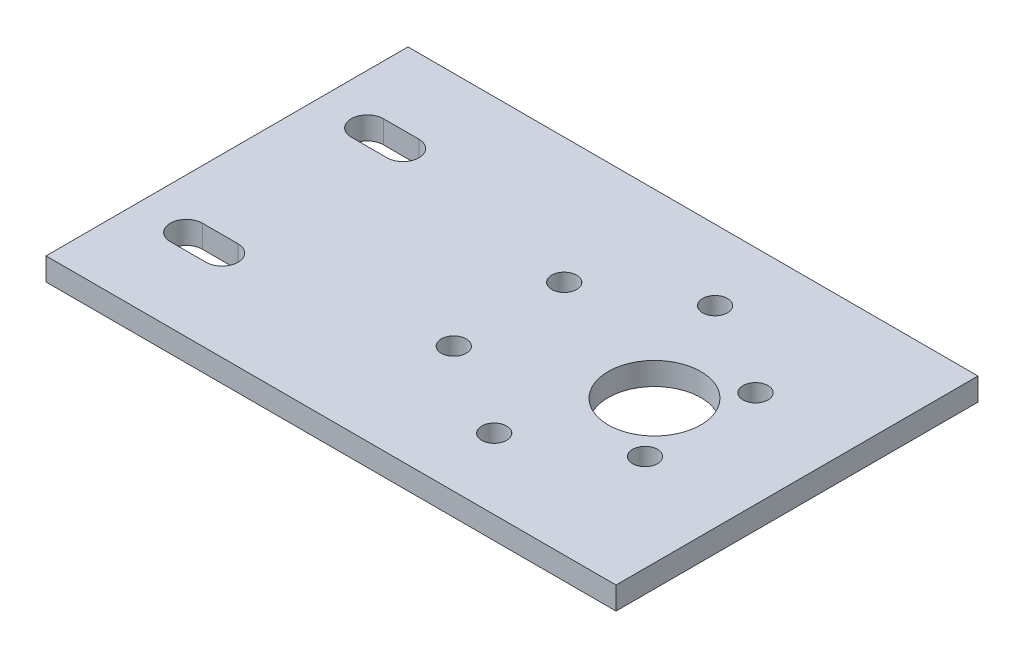
from build123d import *

# Parameters (mm, degrees)
SKETCH1_W           = 80
SKETCH1_H           = 38.1
SKETCH1_R           = 6.5
SKETCH1_R_2         = 1.75
BOSS_EXTRUDE1_DEPTH = 3.175
SKETCH2_W           = 80
SKETCH2_H           = 6.35
BOSS_EXTRUDE2_DEPTH = 3.175


with BuildPart() as part:
    # Sketch1 → Boss-Extrude1 (new body)
    with BuildSketch(Plane(origin=(0, 0, 0), x_dir=(1, 0, 0), z_dir=(0, 1, 0))):
        with Locations((62.55, 19.05)):
            Rectangle(SKETCH1_W, SKETCH1_H)
        with Locations(Location((82.55, 19.05, 0), (0, 0, 270))):
            Circle(SKETCH1_R, mode=Mode.SUBTRACT)
        with Locations(Location((75.55, 34.55, 0), (0, 0, 270))):
            Circle(SKETCH1_R_2, mode=Mode.SUBTRACT)
        with Locations(Location((88.973393759, 26.8, 0), (0, 0, 270))):
            Circle(SKETCH1_R_2, mode=Mode.SUBTRACT)
        with Locations(Location((88.973393759, 11.3, 0), (0, 0, 270))):
            Circle(SKETCH1_R_2, mode=Mode.SUBTRACT)
        with Locations(Location((75.55, 3.55, 0), (0, 0, 270))):
            Circle(SKETCH1_R_2, mode=Mode.SUBTRACT)
        with Locations(Location((62.126606241, 11.3, 0), (0, 0, 270))):
            Circle(SKETCH1_R_2, mode=Mode.SUBTRACT)
        with Locations(Location((62.126606241, 26.8, 0), (0, 0, 270))):
            Circle(SKETCH1_R_2, mode=Mode.SUBTRACT)
        with BuildLine():
            Line((29.55, 29.5), (34.55, 29.5))
            ThreePointArc((34.55, 29.5), (36.8, 31.75), (34.55, 34))
            Line((34.55, 34), (29.55, 34))
            ThreePointArc((29.55, 34), (27.3, 31.75), (29.55, 29.5))
        make_face(mode=Mode.SUBTRACT)
        with BuildLine():
            Line((29.55, 4.1), (34.55, 4.1))
            ThreePointArc((34.55, 4.1), (36.8, 6.35), (34.55, 8.6))
            Line((34.55, 8.6), (29.55, 8.6))
            ThreePointArc((29.55, 8.6), (27.3, 6.35), (29.55, 4.1))
        make_face(mode=Mode.SUBTRACT)
    extrude(amount=BOSS_EXTRUDE1_DEPTH)

    # Sketch2 → Boss-Extrude2 (add)
    with BuildSketch(Plane(origin=(0, 3.175, 0), x_dir=(1, 0, 0), z_dir=(0, 1, 0))):
        with Locations((62.55, 41.275)):
            Rectangle(SKETCH2_W, SKETCH2_H)
        with Locations((62.55, -3.175)):
            Rectangle(SKETCH2_W, SKETCH2_H)
    extrude(amount=-BOSS_EXTRUDE2_DEPTH)


solid = part.part
